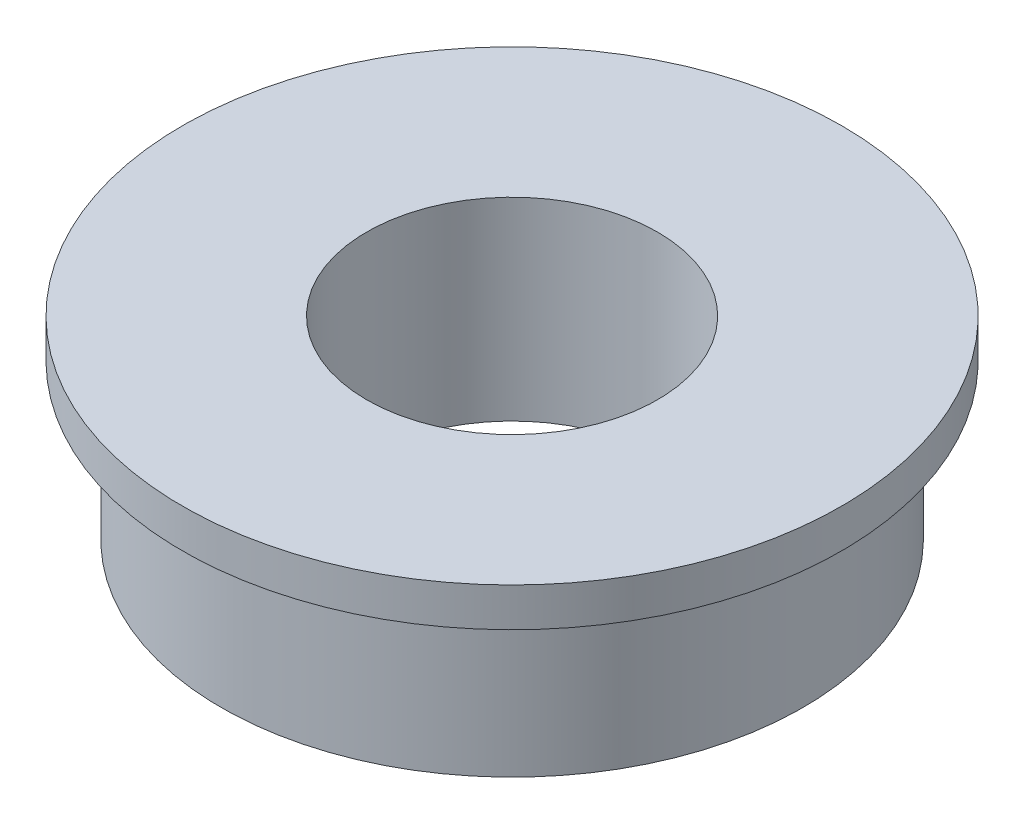
from build123d import *


with BuildPart() as part:
    # Schizzo1 → Rivoluzione1 (revolve)
    with BuildSketch(Plane.XY, mode=Mode.PRIVATE) as rivoluzione1_sk:
        Polygon((3, 4), (3, 0), (6, 0), (6, 3.2), (6.8, 3.2), (6.8, 4), align=None)
    revolve(rivoluzione1_sk.sketch.rotate(Axis((0, 0, 0), (0, 1, 0)), 90), axis=Axis((0, 0, 0), (0, 1, 0)))


solid = part.part
